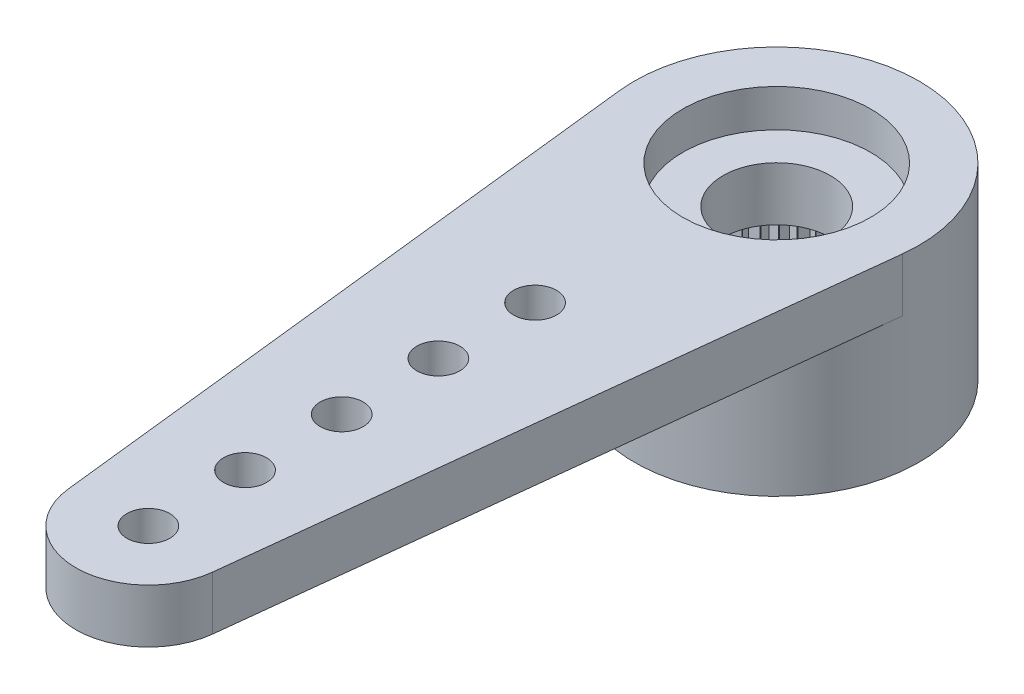
from build123d import *

# Parameters (mm, degrees)
BOSS_EXTRUDE1_DEPTH = 1.27
BOSS_EXTRUDE2_START = 3.175
SKETCH2_R           = 3.3655
BOSS_EXTRUDE2_DEPTH = 3.175
CUT_EXTRUDE1_DEPTH  = 2.286
CUT_EXTRUDE2_START  = -0.889
SKETCH4_R           = 2.2225
CUT_EXTRUDE2_DEPTH  = 0.889
CUT_EXTRUDE3_REACH  = 19.282
SKETCH5_R           = 1.27
CUT_EXTRUDE4_REACH  = 19.486
SKETCH6_R           = 0.508
SCALE1_SCALE        = 1.5


with BuildPart() as part:
    # Sketch1 → Boss-Extrude1 (new body)
    with BuildSketch(Plane(origin=(0, 0, 0), x_dir=(1, 0, 0), z_dir=(0, 1, 0))):
        with BuildLine():
            Line((-1.703883799, -15.0495), (-3.34466079, -0.373944444))
            ThreePointArc((-3.34466079, -0.373944444), (0, 3.3655), (3.34466079, -0.373944444))
            Line((3.34466079, -0.373944444), (1.703883799, -15.0495))
            ThreePointArc((1.703883799, -15.0495), (0, -16.5735), (-1.703883799, -15.0495))
        make_face()
    extrude(amount=BOSS_EXTRUDE1_DEPTH)

    # Sketch2 → Boss-Extrude2 (add)
    with BuildSketch(Plane.XZ.offset(BOSS_EXTRUDE2_START)):
        with Locations(Location((0, 0, 0), (0, 0, 270))):
            Circle(SKETCH2_R)
    extrude(amount=-BOSS_EXTRUDE2_DEPTH)

    # Sketch3 → Cut-Extrude1 (cut)
    with BuildSketch(Plane(origin=(0, -3.175, 0), x_dir=(-1, 0, 0), z_dir=(0, -1, 0))):
        with BuildLine():
            Line((0.344662185, 2.452398872), (0.160511142, 2.216696286))
            ThreePointArc((0.160511142, 2.216696286), (0.155033763, 2.217086102), (0.149555438, 2.217462383))
            Line((0.149555438, 2.217462383), (0, 2.4765))
            Line((0, 2.4765), (-0.149555438, 2.217462383))
            ThreePointArc((-0.149555438, 2.217462383), (-0.155033763, 2.217086102), (-0.160511142, 2.216696286))
            Line((-0.160511142, 2.216696286), (-0.344662185, 2.452398872))
            Line((-0.344662185, 2.452398872), (-0.456711091, 2.175068098))
            ThreePointArc((-0.456711091, 2.175068098), (-0.462083733, 2.173933043), (-0.467453554, 2.172784717))
            Line((-0.467453554, 2.172784717), (-0.682615912, 2.38056459))
            Line((-0.682615912, 2.38056459), (-0.754977382, 2.090338586))
            ThreePointArc((-0.754977382, 2.090338586), (-0.760139769, 2.08846685), (-0.765297515, 2.086582364))
            Line((-0.765297515, 2.086582364), (-1.007283297, 2.262395326))
            Line((-1.007283297, 2.262395326), (-1.038548897, 1.964923011))
            ThreePointArc((-1.038548897, 1.964923011), (-1.043400548, 1.962351025), (-1.04824583, 1.95976706))
            Line((-1.04824583, 1.95976706), (-1.312345058, 2.10019111))
            Line((-1.312345058, 2.10019111), (-1.301906239, 1.801262445))
            ThreePointArc((-1.301906239, 1.801262445), (-1.306352723, 1.79804027), (-1.310791233, 1.794807119))
            Line((-1.310791233, 1.794807119), (-1.591863515, 1.897109063))
            Line((-1.591863515, 1.897109063), (-1.539923457, 1.602542354))
            ThreePointArc((-1.539923457, 1.602542354), (-1.543878228, 1.598732706), (-1.547823575, 1.594913299))
            Line((-1.547823575, 1.594913299), (-1.84039816, 1.657101947))
            Line((-1.84039816, 1.657101947), (-1.747967817, 1.372630599))
            ThreePointArc((-1.747967817, 1.372630599), (-1.7513539, 1.368307629), (-1.754729292, 1.363976306))
            Line((-1.754729292, 1.363976306), (-2.053111548, 1.384841225))
            Line((-2.053111548, 1.384841225), (-1.921989971, 1.116002151))
            ThreePointArc((-1.921989971, 1.116002151), (-1.92474146, 1.11125), (-1.927481199, 1.106491065))
            Line((-1.927481199, 1.106491065), (-2.225863456, 1.085626145))
            Line((-2.225863456, 1.085626145), (-2.058602777, 0.837651991))
            ThreePointArc((-2.058602777, 0.837651991), (-2.060666117, 0.832563154), (-2.062716877, 0.827469234))
            Line((-2.062716877, 0.827469234), (-2.355291463, 0.765280587))
            Line((-2.355291463, 0.765280587), (-2.155147221, 0.542997887))
            ThreePointArc((-2.155147221, 0.542997887), (-2.156482252, 0.537671413), (-2.157804118, 0.532341657))
            Line((-2.157804118, 0.532341657), (-2.4388764, 0.430039712))
            Line((-2.4388764, 0.430039712), (-2.209744176, 0.237774947))
            ThreePointArc((-2.209744176, 0.237774947), (-2.210324912, 0.23231451), (-2.210892156, 0.226852654))
            Line((-2.210892156, 0.226852654), (-2.474991383, 0.086428604))
            Line((-2.474991383, 0.086428604), (-2.221330975, -0.072076012))
            ThreePointArc((-2.221330975, -0.072076012), (-2.221146113, -0.077564131), (-2.220947692, -0.083051778))
            Line((-2.220947692, -0.083051778), (-2.462933474, -0.258864739))
            Line((-2.462933474, -0.258864739), (-2.189682092, -0.380524093))
            ThreePointArc((-2.189682092, -0.380524093), (-2.188735231, -0.385933075), (-2.187775009, -0.391339701))
            Line((-2.187775009, -0.391339701), (-2.402937366, -0.599119574))
            Line((-2.402937366, -0.599119574), (-2.115413539, -0.681565705))
            ThreePointArc((-2.115413539, -0.681565705), (-2.113723107, -0.68679027), (-2.112019773, -0.692010642))
            Line((-2.112019773, -0.692010642), (-2.296170816, -0.927713229))
            Line((-2.296170816, -0.927713229), (-1.999970867, -0.969341417))
            ThreePointArc((-1.999970867, -0.969341417), (-1.997569768, -0.974279874), (-1.995156475, -0.979212383))
            Line((-1.995156475, -0.979212383), (-2.144711912, -1.23825))
            Line((-2.144711912, -1.23825), (-1.845601037, -1.23825))
            ThreePointArc((-1.845601037, -1.23825), (-1.842536005, -1.242806228), (-1.839459725, -1.247354869))
            Line((-1.839459725, -1.247354869), (-1.951508631, -1.524685644))
            Line((-1.951508631, -1.524685644), (-1.655308682, -1.483057456))
            ThreePointArc((-1.655308682, -1.483057456), (-1.651639375, -1.487142773), (-1.647959984, -1.491219011))
            Line((-1.647959984, -1.491219011), (-1.720321454, -1.781445016))
            Line((-1.720321454, -1.781445016), (-1.432797627, -1.698998885))
            ThreePointArc((-1.432797627, -1.698998885), (-1.428595463, -1.702533775), (-1.424384577, -1.706058272))
            Line((-1.424384577, -1.706058272), (-1.455650177, -2.003530587))
            Line((-1.455650177, -2.003530587), (-1.182398796, -1.881871233))
            ThreePointArc((-1.182398796, -1.881871233), (-1.177745565, -1.884786894), (-1.173085144, -1.887691048))
            Line((-1.173085144, -1.887691048), (-1.162646325, -2.186619714))
            Line((-1.162646325, -2.186619714), (-0.908985917, -2.028115099))
            ThreePointArc((-0.908985917, -2.028115099), (-0.903972189, -2.03035478), (-0.898952943, -2.032582066))
            Line((-0.898952943, -2.032582066), (-0.847012885, -2.327148775))
            Line((-0.847012885, -2.327148775), (-0.617880661, -2.134884011))
            ThreePointArc((-0.617880661, -2.134884011), (-0.612604023, -2.136404119), (-0.607323646, -2.137911186))
            Line((-0.607323646, -2.137911186), (-0.514893302, -2.422382533))
            Line((-0.514893302, -2.422382533), (-0.314749061, -2.200099834))
            ThreePointArc((-0.314749061, -2.200099834), (-0.309312217, -2.200870783), (-0.303873485, -2.201628296))
            Line((-0.303873485, -2.201628296), (-0.172751907, -2.47046737))
            Line((-0.172751907, -2.47046737), (-0.005491228, -2.222493216))
            ThreePointArc((-0.005491228, -2.222493216), (0, -2.2225), (0.005491228, -2.222493216))
            Line((0.005491228, -2.222493216), (0.172751907, -2.47046737))
            Line((0.172751907, -2.47046737), (0.303873485, -2.201628296))
            ThreePointArc((0.303873485, -2.201628296), (0.309312217, -2.200870783), (0.314749061, -2.200099834))
            Line((0.314749061, -2.200099834), (0.514893302, -2.422382533))
            Line((0.514893302, -2.422382533), (0.607323646, -2.137911186))
            ThreePointArc((0.607323646, -2.137911186), (0.612604023, -2.136404119), (0.617880661, -2.134884011))
            Line((0.617880661, -2.134884011), (0.847012885, -2.327148775))
            Line((0.847012885, -2.327148775), (0.898952943, -2.032582066))
            ThreePointArc((0.898952943, -2.032582066), (0.903972189, -2.03035478), (0.908985917, -2.028115099))
            Line((0.908985917, -2.028115099), (1.162646325, -2.186619714))
            Line((1.162646325, -2.186619714), (1.173085144, -1.887691048))
            ThreePointArc((1.173085144, -1.887691048), (1.177745565, -1.884786894), (1.182398796, -1.881871233))
            Line((1.182398796, -1.881871233), (1.455650177, -2.003530587))
            Line((1.455650177, -2.003530587), (1.424384577, -1.706058272))
            ThreePointArc((1.424384577, -1.706058272), (1.428595463, -1.702533775), (1.432797627, -1.698998885))
            Line((1.432797627, -1.698998885), (1.720321454, -1.781445016))
            Line((1.720321454, -1.781445016), (1.647959984, -1.491219011))
            ThreePointArc((1.647959984, -1.491219011), (1.651639375, -1.487142773), (1.655308682, -1.483057456))
            Line((1.655308682, -1.483057456), (1.951508631, -1.524685644))
            Line((1.951508631, -1.524685644), (1.839459725, -1.247354869))
            ThreePointArc((1.839459725, -1.247354869), (1.842536005, -1.242806228), (1.845601037, -1.23825))
            Line((1.845601037, -1.23825), (2.144711912, -1.23825))
            Line((2.144711912, -1.23825), (1.995156475, -0.979212383))
            ThreePointArc((1.995156475, -0.979212383), (1.997569768, -0.974279874), (1.999970867, -0.969341417))
            Line((1.999970867, -0.969341417), (2.296170816, -0.927713229))
            Line((2.296170816, -0.927713229), (2.112019773, -0.692010642))
            ThreePointArc((2.112019773, -0.692010642), (2.113723107, -0.68679027), (2.115413539, -0.681565705))
            Line((2.115413539, -0.681565705), (2.402937366, -0.599119574))
            Line((2.402937366, -0.599119574), (2.187775009, -0.391339701))
            ThreePointArc((2.187775009, -0.391339701), (2.188735231, -0.385933075), (2.189682092, -0.380524093))
            Line((2.189682092, -0.380524093), (2.462933474, -0.258864739))
            Line((2.462933474, -0.258864739), (2.220947692, -0.083051778))
            ThreePointArc((2.220947692, -0.083051778), (2.221146113, -0.077564131), (2.221330975, -0.072076012))
            Line((2.221330975, -0.072076012), (2.474991383, 0.086428604))
            Line((2.474991383, 0.086428604), (2.210892156, 0.226852654))
            ThreePointArc((2.210892156, 0.226852654), (2.210324912, 0.23231451), (2.209744176, 0.237774947))
            Line((2.209744176, 0.237774947), (2.4388764, 0.430039712))
            Line((2.4388764, 0.430039712), (2.157804118, 0.532341657))
            ThreePointArc((2.157804118, 0.532341657), (2.156482252, 0.537671413), (2.155147221, 0.542997887))
            Line((2.155147221, 0.542997887), (2.355291463, 0.765280587))
            Line((2.355291463, 0.765280587), (2.062716877, 0.827469234))
            ThreePointArc((2.062716877, 0.827469234), (2.060666117, 0.832563154), (2.058602777, 0.837651991))
            Line((2.058602777, 0.837651991), (2.225863456, 1.085626145))
            Line((2.225863456, 1.085626145), (1.927481199, 1.106491065))
            ThreePointArc((1.927481199, 1.106491065), (1.92474146, 1.11125), (1.921989971, 1.116002151))
            Line((1.921989971, 1.116002151), (2.053111548, 1.384841225))
            Line((2.053111548, 1.384841225), (1.754729292, 1.363976306))
            ThreePointArc((1.754729292, 1.363976306), (1.7513539, 1.368307629), (1.747967817, 1.372630599))
            Line((1.747967817, 1.372630599), (1.84039816, 1.657101947))
            Line((1.84039816, 1.657101947), (1.547823575, 1.594913299))
            ThreePointArc((1.547823575, 1.594913299), (1.543878228, 1.598732706), (1.539923457, 1.602542354))
            Line((1.539923457, 1.602542354), (1.591863515, 1.897109063))
            Line((1.591863515, 1.897109063), (1.310791233, 1.794807119))
            ThreePointArc((1.310791233, 1.794807119), (1.306352723, 1.79804027), (1.301906239, 1.801262445))
            Line((1.301906239, 1.801262445), (1.312345058, 2.10019111))
            Line((1.312345058, 2.10019111), (1.04824583, 1.95976706))
            ThreePointArc((1.04824583, 1.95976706), (1.043400548, 1.962351025), (1.038548897, 1.964923011))
            Line((1.038548897, 1.964923011), (1.007283297, 2.262395326))
            Line((1.007283297, 2.262395326), (0.765297515, 2.086582364))
            ThreePointArc((0.765297515, 2.086582364), (0.760139769, 2.08846685), (0.754977382, 2.090338586))
            Line((0.754977382, 2.090338586), (0.682615912, 2.38056459))
            Line((0.682615912, 2.38056459), (0.467453554, 2.172784717))
            ThreePointArc((0.467453554, 2.172784717), (0.462083733, 2.173933043), (0.456711091, 2.175068098))
            Line((0.456711091, 2.175068098), (0.344662185, 2.452398872))
        make_face()
    extrude(amount=-CUT_EXTRUDE1_DEPTH, mode=Mode.SUBTRACT)

    # Sketch4 → Cut-Extrude2 (cut)
    with BuildSketch(Plane(origin=(0, 1.27, 0), x_dir=(1, 0, 0), z_dir=(0, 1, 0)).offset(CUT_EXTRUDE2_START)):
        with Locations(Location((0, 0, 0), (0, 0, 270))):
            Circle(SKETCH4_R)
    extrude(amount=CUT_EXTRUDE2_DEPTH, mode=Mode.SUBTRACT)

    # Sketch5 → Cut-Extrude3 (cut, up to next)
    with BuildSketch(Plane(origin=(0, 0.381, 0), x_dir=(1, 0, 0), z_dir=(0, 1, 0)), mode=Mode.PRIVATE) as cut_extrude3_sk1:
        with Locations(Location((0, 0, 0), (0, 0, 270))):
            Circle(SKETCH5_R)
    cut_extrude3_tool1 = extrude(cut_extrude3_sk1.sketch, amount=-CUT_EXTRUDE3_REACH, mode=Mode.PRIVATE) & part.part
    add(cut_extrude3_tool1.solids().sort_by_distance((0, 0.381, 0))[0], mode=Mode.SUBTRACT)

    # Sketch6 → Cut-Extrude4 (cut, up to next)
    with BuildSketch(Plane(origin=(0, 1.27, 0), x_dir=(1, 0, 0), z_dir=(0, 1, 0)), mode=Mode.PRIVATE) as cut_extrude4_sk1:
        with Locations(Location((0, -14.859, 0), (0, 0, 270))):
            Circle(SKETCH6_R)
    cut_extrude4_tool1 = extrude(cut_extrude4_sk1.sketch, amount=-CUT_EXTRUDE4_REACH, mode=Mode.PRIVATE) & part.part
    # Sketch6 → Cut-Extrude4 (cut, up to next)
    with BuildSketch(Plane(origin=(0, 1.27, 0), x_dir=(1, 0, 0), z_dir=(0, 1, 0)), mode=Mode.PRIVATE) as cut_extrude4_sk2:
        with Locations(Location((0, -12.573, 0), (0, 0, 270))):
            Circle(SKETCH6_R)
    cut_extrude4_tool2 = extrude(cut_extrude4_sk2.sketch, amount=-CUT_EXTRUDE4_REACH, mode=Mode.PRIVATE) & part.part
    # Sketch6 → Cut-Extrude4 (cut, up to next)
    with BuildSketch(Plane(origin=(0, 1.27, 0), x_dir=(1, 0, 0), z_dir=(0, 1, 0)), mode=Mode.PRIVATE) as cut_extrude4_sk3:
        with Locations(Location((0, -10.287, 0), (0, 0, 270))):
            Circle(SKETCH6_R)
    cut_extrude4_tool3 = extrude(cut_extrude4_sk3.sketch, amount=-CUT_EXTRUDE4_REACH, mode=Mode.PRIVATE) & part.part
    # Sketch6 → Cut-Extrude4 (cut, up to next)
    with BuildSketch(Plane(origin=(0, 1.27, 0), x_dir=(1, 0, 0), z_dir=(0, 1, 0)), mode=Mode.PRIVATE) as cut_extrude4_sk4:
        with Locations(Location((0, -8.001, 0), (0, 0, 270))):
            Circle(SKETCH6_R)
    cut_extrude4_tool4 = extrude(cut_extrude4_sk4.sketch, amount=-CUT_EXTRUDE4_REACH, mode=Mode.PRIVATE) & part.part
    # Sketch6 → Cut-Extrude4 (cut, up to next)
    with BuildSketch(Plane(origin=(0, 1.27, 0), x_dir=(1, 0, 0), z_dir=(0, 1, 0)), mode=Mode.PRIVATE) as cut_extrude4_sk5:
        with Locations(Location((0, -5.715, 0), (0, 0, 270))):
            Circle(SKETCH6_R)
    cut_extrude4_tool5 = extrude(cut_extrude4_sk5.sketch, amount=-CUT_EXTRUDE4_REACH, mode=Mode.PRIVATE) & part.part
    add(cut_extrude4_tool1.solids().sort_by_distance((0, 1.27, 14.859))[0], mode=Mode.SUBTRACT)
    add(cut_extrude4_tool2.solids().sort_by_distance((0, 1.27, 12.573))[0], mode=Mode.SUBTRACT)
    add(cut_extrude4_tool3.solids().sort_by_distance((0, 1.27, 10.287))[0], mode=Mode.SUBTRACT)
    add(cut_extrude4_tool4.solids().sort_by_distance((0, 1.27, 8.001))[0], mode=Mode.SUBTRACT)
    add(cut_extrude4_tool5.solids().sort_by_distance((0, 1.27, 5.715))[0], mode=Mode.SUBTRACT)


with BuildPart() as part_1:
    # Scale1: scaled about (0, -0.191048753, 3.726137678)
    add(part.part.scale(SCALE1_SCALE).moved(Location((0, 0.095524376, -1.863068839))))


solid = part_1.part
